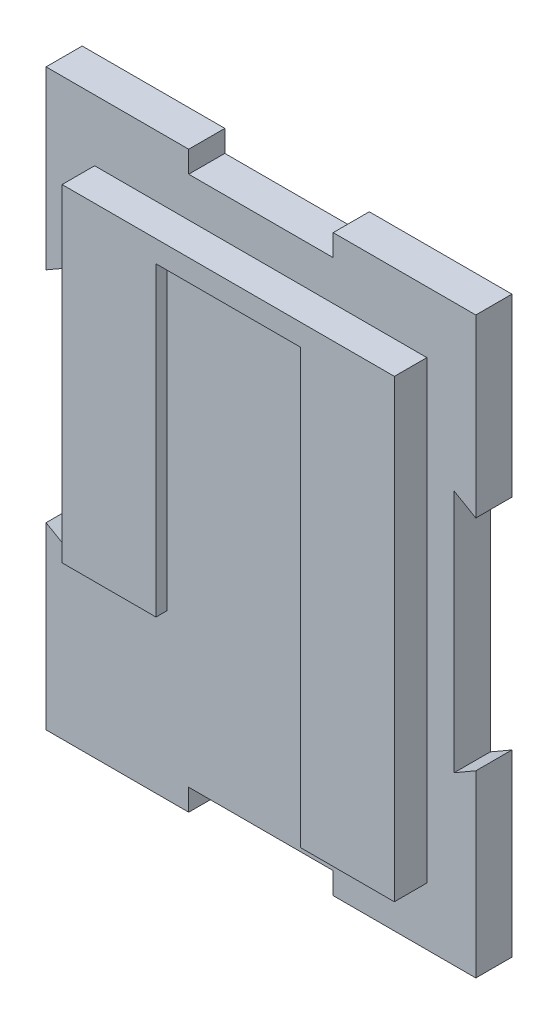
from build123d import *

# Parameters (mm, degrees)
BOSS_EXTRUDE1_DEPTH = 5
BOSS_EXTRUDE2_START = -5
SKETCH6_W           = 3
SKETCH6_H           = 3
SKETCH6_H_2         = 1.5
SKETCH6_W_2         = 10
BOSS_EXTRUDE2_DEPTH = 60
SKETCH7_W           = 46
SKETCH7_H           = 4.5
BOSS_EXTRUDE3_DEPTH = 3
SKETCH8_W           = 50
SKETCH8_H           = 70
CUT_EXTRUDE2_DEPTH  = 1
SKETCH9_R           = 1
BOSS_EXTRUDE4_DEPTH = 1
CUT_EXTRUDE3_REACH  = 52.551
SKETCH10_W          = 13.006782721
SKETCH10_H          = 17.639239295


with BuildPart() as part:
    # Sketch4 → Boss-Extrude1 (new body)
    with BuildSketch(Plane(origin=(0, 0, 0), x_dir=(0, 1, 0), z_dir=(0, 0, 1))):
        Polygon((-39.75, -29.75), (-14.905444566, -29.75), (-16.637495374, -26.75), (0.24999995, -26.75), (17.137495374, -26.75), (15.405444566, -29.75), (39.75, -29.75), (39.75, -10), (36.75, -10), (36.75, 10), (39.75, 10), (39.75, 29.75), (15.405444566, 29.75), (17.137495374, 26.75), (0.250000065, 26.75), (-16.637495374, 26.75), (-14.905444566, 29.75), (-39.75, 29.75), (-39.75, 10), (-36.75, 10), (-36.75, -10), (-39.75, -10), align=None)
    extrude(amount=BOSS_EXTRUDE1_DEPTH)

    # Sketch6 → Boss-Extrude2 (add)
    with BuildSketch(Plane.XZ.offset(36.75).offset(BOSS_EXTRUDE2_START)):
        with Locations((-21.528635138, 6.5)):
            Rectangle(SKETCH6_W, SKETCH6_H)
        with Locations((-21.528635138, 8.75)):
            Rectangle(SKETCH6_W, SKETCH6_H_2)
        with Locations((-15.028635138, 8.75)):
            Rectangle(SKETCH6_W_2, SKETCH6_H_2)
        with Locations((21.471364862, 6.5)):
            Rectangle(SKETCH6_W, SKETCH6_H)
        with Locations((21.471364862, 8.75)):
            Rectangle(SKETCH6_W, SKETCH6_H_2)
        with Locations((14.971364862, 8.75)):
            Rectangle(SKETCH6_W_2, SKETCH6_H_2)
    extrude(amount=-BOSS_EXTRUDE2_DEPTH)

    # Sketch7 → Boss-Extrude3 (add)
    with BuildSketch(Plane(origin=(0, 28.25, 0), x_dir=(-1, 0, 0), z_dir=(0, 1, 0))):
        with Locations((0.028635138, 7.25)):
            Rectangle(SKETCH7_W, SKETCH7_H)
    extrude(amount=BOSS_EXTRUDE3_DEPTH)

    # Sketch8 → Cut-Extrude2 (cut)
    with BuildSketch(Plane(origin=(0, 0, 0), x_dir=(1, 0, 0), z_dir=(0, 0, -1))):
        Rectangle(SKETCH8_W, SKETCH8_H)
    extrude(amount=-CUT_EXTRUDE2_DEPTH, mode=Mode.SUBTRACT)

    # Sketch9 → Boss-Extrude4 (add)
    # profile 1 of 14: a face of its own
    with BuildSketch(Plane(origin=(0, 0, 1), x_dir=(1, 0, 0), z_dir=(0, 0, -1))):
        with Locations((-12.786487011, -17.078606255)):
            Circle(SKETCH9_R)
    # profile 2 of 14: a face of its own
    with BuildSketch(Plane(origin=(0, 0, 1), x_dir=(1, 0, 0), z_dir=(0, 0, -1))):
        with Locations((-6.463434267, -17.078606255)):
            Circle(SKETCH9_R)
    # profile 3 of 14: a face of its own
    with BuildSketch(Plane(origin=(0, 0, 1), x_dir=(1, 0, 0), z_dir=(0, 0, -1))):
        with Locations((0, -17.078606255)):
            Circle(SKETCH9_R)
    # profile 4 of 14: a face of its own
    with BuildSketch(Plane(origin=(0, 0, 1), x_dir=(1, 0, 0), z_dir=(0, 0, -1))):
        with Locations((0, -14.125611289)):
            Circle(SKETCH9_R)
    # profile 5 of 14: a face of its own
    with BuildSketch(Plane(origin=(0, 0, 1), x_dir=(1, 0, 0), z_dir=(0, 0, -1))):
        with Locations((2.94008007, -14.125611289)):
            Circle(SKETCH9_R)
    # profile 6 of 14: a face of its own
    with BuildSketch(Plane(origin=(0, 0, 1), x_dir=(1, 0, 0), z_dir=(0, 0, -1))):
        with Locations((2.94008007, -11.346566296)):
            Circle(SKETCH9_R)
    # profile 7 of 14: a face of its own
    with BuildSketch(Plane(origin=(0, 0, 1), x_dir=(1, 0, 0), z_dir=(0, 0, -1))):
        with Locations((6.560973521, -11.346566296)):
            Circle(SKETCH9_R)
    # profile 8 of 14: a face of its own
    with BuildSketch(Plane(origin=(0, 0, 1), x_dir=(1, 0, 0), z_dir=(0, 0, -1))):
        with Locations((12.343594407, -11.346566296)):
            Circle(SKETCH9_R)
    # profile 9 of 14: a face of its own
    with BuildSketch(Plane(origin=(0, 0, 1), x_dir=(1, 0, 0), z_dir=(0, 0, -1))):
        with Locations((12.343594407, -14.125611289)):
            Circle(SKETCH9_R)
    # profile 10 of 14: a face of its own
    with BuildSketch(Plane(origin=(0, 0, 1), x_dir=(1, 0, 0), z_dir=(0, 0, -1))):
        with Locations((12.343594407, -17.078606255)):
            Circle(SKETCH9_R)
    # profile 11 of 14: a face of its own
    with BuildSketch(Plane(origin=(0, 0, 1), x_dir=(1, 0, 0), z_dir=(0, 0, -1))):
        with Locations((15.424056, -11.346566296)):
            Circle(SKETCH9_R)
    # profile 12 of 14: a face of its own
    with BuildSketch(Plane(origin=(0, 0, 1), x_dir=(1, 0, 0), z_dir=(0, 0, -1))):
        Polygon((-6.303627236, 4.647475362), (-9.872238462, 4.647475362), (-9.872238462, -6.382777516), (-11.332124872, -6.382777516), (-11.332124872, 4.647475362), (-14.900736097, 4.647475362), (-14.900736097, 5.945152171), (-6.303627236, 5.945152171), align=None)
    # profile 13 of 14: a face of its own
    with BuildSketch(Plane(origin=(0, 0, 1), x_dir=(1, 0, 0), z_dir=(0, 0, -1))):
        Polygon((5.213254446, -6.382777516), (3.606365584, -6.382777516), (2.30615425, -2.976375892), (-2.985933988, -2.976375892), (-4.199971471, -6.382777516), (-5.816998433, -6.382777516), (-1.062229499, 5.945152171), (0.440743837, 5.945152171), align=None)
        with BuildLine():
            Line((1.829663547, -1.678699083), (-0.132058817, 3.65647608))
            add(Edge.make_bspline(
                [(-0.132058817, 3.65647608), (-0.147664764, 3.706203134), (-0.182599633, 3.817520196), (-0.230569306, 4.004992715), (-0.27451989, 4.232251444), (-0.303796625, 4.396518738), (-0.319613669, 4.485265761)],
                knots=[0, 0, 0, 0, 0.735233958, 1.645866306, 2.728156085, 4, 4, 4, 4], degree=3))
            Line((-0.319613669, 4.485265761), (-0.352562494, 4.485265761))
            add(Edge.make_bspline(
                [(-0.352562494, 4.485265761), (-0.367323874, 4.402388942), (-0.395422699, 4.244629907), (-0.442062801, 4.022554742), (-0.494871195, 3.828782863), (-0.536126975, 3.711193738), (-0.555324495, 3.65647608)],
                knots=[0, 0, 0, 0, 1.1821815, 2.250325448, 3.185825268, 4, 4, 4, 4], degree=3))
            Line((-0.555324495, 3.65647608), (-2.506908759, -1.678699083))
            Line((-2.506908759, -1.678699083), (1.829663547, -1.678699083))
        make_face(mode=Mode.SUBTRACT)
    # profile 14 of 14: a face of its own
    with BuildSketch(Plane(origin=(0, 0, 1), x_dir=(1, 0, 0), z_dir=(0, 0, -1))):
        with BuildLine():
            Line((8.457446469, -1.678699083), (8.457446469, -6.382777516))
            Line((8.457446469, -6.382777516), (6.997560058, -6.382777516))
            Line((6.997560058, -6.382777516), (6.997560058, 5.945152171))
            Line((6.997560058, 5.945152171), (10.350736657, 5.945152171))
            add(Edge.make_bspline(
                [(10.350736657, 5.945152171), (10.509695311, 5.94250725), (10.818166439, 5.937374583), (11.266927294, 5.88984235), (11.688470568, 5.818158675), (12.083717966, 5.715231867), (12.449844904, 5.577532383), (12.788978426, 5.411630082), (13.10398336, 5.220680323), (13.384579674, 4.991925283), (13.640330715, 4.742713756), (13.858595137, 4.463555677), (14.046290599, 4.161729634), (14.198048848, 3.833912071), (14.314343043, 3.48152593), (14.397958134, 3.105462584), (14.449017319, 2.704893846), (14.455752673, 2.42907422), (14.459201711, 2.28783257)],
                knots=[0, 0, 0, 0, 1.220578922, 2.368624473, 3.462135539, 4.502544785, 5.500522599, 6.461134096, 7.399369976, 8.322607956, 9.235733545, 10.136695962, 11.037097352, 11.960312526, 12.90425338, 13.881897398, 14.915362519, 16, 16, 16, 16], degree=3))
            add(Edge.make_bspline(
                [(14.459201711, 2.28783257), (14.456125133, 2.145713753), (14.450093475, 1.867088625), (14.392842954, 1.458577322), (14.298798135, 1.070067677), (14.170811012, 0.698864827), (13.997972005, 0.351851734), (13.795716853, 0.020347803), (13.548830266, -0.286010644), (13.271970609, -0.574267746), (12.963200376, -0.836054299), (12.624253148, -1.061978102), (12.259784751, -1.253070736), (11.868668942, -1.407989064), (11.451812999, -1.528768286), (11.009560292, -1.618354116), (10.541130741, -1.668202008), (10.220744681, -1.675144873), (10.056731755, -1.678699083)],
                knots=[0, 0, 0, 0, 1.022395889, 2.004415688, 2.961535425, 3.896140743, 4.82343876, 5.746400737, 6.685563929, 7.648805907, 8.619636875, 9.592693104, 10.574524643, 11.576040996, 12.61506259, 13.694246144, 14.819632053, 16, 16, 16, 16], degree=3))
            Line((10.056731755, -1.678699083), (8.457446469, -1.678699083))
        make_face()
        with BuildLine():
            Line((8.457446469, 4.647475362), (8.457446469, -0.381022274))
            Line((8.457446469, -0.381022274), (9.957885279, -0.381022274))
            add(Edge.make_bspline(
                [(9.957885279, -0.381022274), (10.077940481, -0.379452684), (10.31093283, -0.376406565), (10.649599833, -0.342109598), (10.966509261, -0.289852539), (11.262229227, -0.217435817), (11.534525044, -0.120826947), (11.784771245, -0.00343225), (12.015027367, 0.132656375), (12.220130693, 0.293746461), (12.40507983, 0.471885839), (12.564099334, 0.670006443), (12.701263006, 0.885087886), (12.808528198, 1.119672064), (12.896289259, 1.369569482), (12.956358781, 1.637465518), (12.991871549, 1.922744559), (12.996789996, 2.118759427), (12.999315301, 2.219400395)],
                knots=[0, 0, 0, 0, 1.265277681, 2.455537233, 3.584498775, 4.649494157, 5.660845971, 6.625094694, 7.559934571, 8.473920379, 9.368340756, 10.261385271, 11.146040016, 12.050559185, 12.974472874, 13.933813817, 14.939146914, 16, 16, 16, 16], degree=3))
            add(Edge.make_bspline(
                [(12.999315301, 2.219400395), (12.997979793, 2.317539924), (12.995379811, 2.508599083), (12.957720492, 2.784773853), (12.904092134, 3.042639571), (12.823919422, 3.279856734), (12.726105371, 3.500854512), (12.600929429, 3.700909707), (12.454878872, 3.883183964), (12.286699993, 4.047522092), (12.093084536, 4.187745781), (11.87946034, 4.311880083), (11.642587123, 4.414603882), (11.384078714, 4.500966841), (11.102977848, 4.565807264), (10.800766648, 4.614221035), (10.475423413, 4.641369896), (10.251093913, 4.6453968), (10.13530203, 4.647475362)],
                knots=[0, 0, 0, 0, 1.094831488, 2.131430464, 3.106461648, 4.031144782, 4.921863596, 5.798739979, 6.657572552, 7.524756014, 8.415225068, 9.319623649, 10.278320726, 11.292489325, 12.358664814, 13.495361146, 14.707183632, 16, 16, 16, 16], degree=3))
            Line((10.13530203, 4.647475362), (8.457446469, 4.647475362))
        make_face(mode=Mode.SUBTRACT)
    extrude(amount=BOSS_EXTRUDE4_DEPTH)

    # Cut-Extrude3: up to this face of the body (flat: up to its plane)
    cut_extrude3_end = Plane(part.part.faces().sort_by_distance((0.003637838, -0.898870224, 5))[0])
    # Sketch10 → Cut-Extrude3 (cut, up to the picked face)
    with BuildSketch(Plane.XY.offset(9.5), mode=Mode.PRIVATE) as cut_extrude3_sk1:
        with Locations((-16.525243778, -22.930380353)):
            Rectangle(SKETCH10_W, SKETCH10_H)
    cut_extrude3_tool1 = split(extrude(cut_extrude3_sk1.sketch, amount=-CUT_EXTRUDE3_REACH, mode=Mode.PRIVATE), bisect_by=cut_extrude3_end, keep=Keep.BOTH, mode=Mode.PRIVATE)
    add(cut_extrude3_tool1.solids().sort_by(Axis((-16.525244, -22.93038, 9.5), (0, 0, -1)))[0], mode=Mode.SUBTRACT)


solid = part.part
